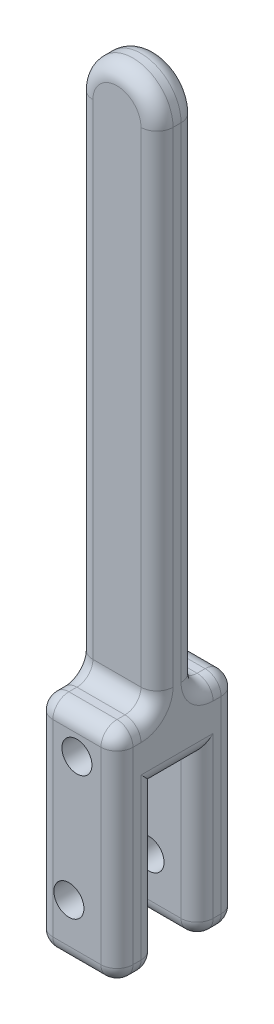
from build123d import *

# Parameters (mm, degrees)
SKETCH1_W                       = 12.7
SKETCH1_H                       = 114.3
BOSS_EXTRUDE1_DEPTH             = 6.35
SKETCH4_W                       = 12.7
SKETCH4_H                       = 28.575
BOSS_EXTRUDE3_DEPTH             = 6.35
SKETCH5_W                       = 12.7
SKETCH5_H                       = 28.575
BOSS_EXTRUDE4_DEPTH             = 6.35
SKETCH7_W                       = 6.35
SKETCH7_H                       = 19.05
CUT_EXTRUDE2_DEPTH              = 32.512
CUT_EXTRUDE3_DEPTH              = 116.702506455
CUT_EXTRUDE3_DEPTH_BACK         = 116.702506455
SKETCH8_R                       = 2.38125
FILLET5_RADIUS                  = 6.35
FILLET5_LENGTH                  = 6.35
SKETCH9_W                       = 12.7
SKETCH9_H                       = 6.35
BOSS_EXTRUDE5_DEPTH             = 6.35
FILLET6_R                       = 2.54
F_3_16_0_1875_DOWEL_HOLE1_D     = 4.7625
F_3_16_0_1875_DOWEL_HOLE1_DEPTH = 23.368
F_3_16_0_1875_DOWEL_HOLE1_TIP   = 1.430799349


with BuildPart() as part:
    # Sketch1 → Boss-Extrude1 (new body)
    with BuildSketch(Plane.XY):
        with Locations((6.35, 57.15)):
            Rectangle(SKETCH1_W, SKETCH1_H)
    extrude(amount=BOSS_EXTRUDE1_DEPTH)

    # Sketch4 → Boss-Extrude3 (add)
    with BuildSketch(Plane.XY.offset(6.35)):
        with Locations((6.35, 14.2875)):
            Rectangle(SKETCH4_W, SKETCH4_H)
    extrude(amount=BOSS_EXTRUDE3_DEPTH)

    # Sketch5 → Boss-Extrude4 (add)
    with BuildSketch(Plane(origin=(0, 0, 0), x_dir=(-1, 0, 0), z_dir=(0, 0, -1))):
        with Locations((-6.35, 14.2875)):
            Rectangle(SKETCH5_W, SKETCH5_H)
    extrude(amount=BOSS_EXTRUDE4_DEPTH)

    # Sketch7 → Cut-Extrude2 (cut)
    with BuildSketch(Plane.ZY):
        with Locations((3.175, 9.525)):
            Rectangle(SKETCH7_W, SKETCH7_H)
    extrude(amount=-CUT_EXTRUDE2_DEPTH, mode=Mode.SUBTRACT)

    # Sketch8 → Cut-Extrude3 (cut, two sides: drawn at the far end of the back side and taken through both)
    with BuildSketch(Plane.XY.offset(6.35).offset(-CUT_EXTRUDE3_DEPTH_BACK)):
        with Locations((6.35, 22.86)):
            Circle(SKETCH8_R)
    extrude(amount=CUT_EXTRUDE3_DEPTH + CUT_EXTRUDE3_DEPTH_BACK, mode=Mode.SUBTRACT)

    # Fillet5: full round fillet: the end face becomes a half cylinder, R = half its width
    fillet5_face = Plane((6.35, 114.3, 3.175), x_dir=(0, 0, 1), z_dir=(0, 1, 0))  # on the end face: x along it, z out of the body
    fillet5_slab = fillet5_face.offset(-FILLET5_RADIUS / 2) * Box(FILLET5_LENGTH, 2 * FILLET5_RADIUS, FILLET5_RADIUS, mode=Mode.PRIVATE)  # the body's end, R deep
    fillet5_round = Plane((6.35, 107.95, 3.175), x_dir=(0, 1, 0), z_dir=(0, 0, 1)) * Cylinder(FILLET5_RADIUS, FILLET5_LENGTH, mode=Mode.PRIVATE)  # its axis R under the face
    add(fillet5_slab - fillet5_round, mode=Mode.SUBTRACT)

    # Sketch9 → Boss-Extrude5 (add)
    with BuildSketch(Plane.XZ):
        with Locations((6.35, -3.175)):
            Rectangle(SKETCH9_W, SKETCH9_H)
        with Locations((6.35, 9.525)):
            Rectangle(SKETCH9_W, SKETCH9_H)
    extrude(amount=BOSS_EXTRUDE5_DEPTH)

    # Fillet6
    fillet6_edges = [part.edges().sort_by_distance(p)[0] for p in [
        (12.7, 68.2625, 6.35),
        (0, 28.575, 9.525),
        (6.35, 28.575, 6.35),
        (12.7, 28.575, 9.525),
        (0, 11.1125, 12.7),
        (12.7, 11.1125, 12.7),
        (6.35, 28.575, 12.7),
        (12.7, 68.2625, 0),
        (12.7, 28.575, -3.175),
        (6.35, 28.575, 0),
        (0, 28.575, -3.175),
        (12.7, 14.2875, -6.35),
        (0, 14.2875, -6.35),
        (6.35, 28.575, -6.35),
        (12.7, 9.525, 6.35),
        (12.7, 19.05, 3.175),
        (12.7, 9.525, 0),
        (0, 9.525, 0),
        (0, 9.525, 6.35),
        (0, 19.05, 3.175),
        (0, 68.2625, 6.35),
        (0, 68.2625, 0),
        (6.35, 114.3, 0),
        (6.35, 114.3, 6.35),
        (6.35, -6.35, -6.35),
        (12.7, -6.35, -3.175),
        (6.35, -6.35, 0),
        (0, -6.35, -3.175),
        (6.35, -6.35, 12.7),
        (0, -6.35, 9.525),
        (6.35, -6.35, 6.35),
        (12.7, -6.35, 9.525),
    ]]
    fillet(fillet6_edges, radius=FILLET6_R)

    # 3/16 (0.1875) Dowel Hole1
    with Locations(Plane.XY.offset(12.7)):
        with Locations((5.08, 2.54)):
            Hole(F_3_16_0_1875_DOWEL_HOLE1_D / 2, depth=F_3_16_0_1875_DOWEL_HOLE1_DEPTH)
            with Locations((0, 0, -(F_3_16_0_1875_DOWEL_HOLE1_DEPTH + F_3_16_0_1875_DOWEL_HOLE1_TIP / 2))):  # 118° drill point
                Cone(0, F_3_16_0_1875_DOWEL_HOLE1_D / 2, F_3_16_0_1875_DOWEL_HOLE1_TIP, mode=Mode.SUBTRACT)


solid = part.part
